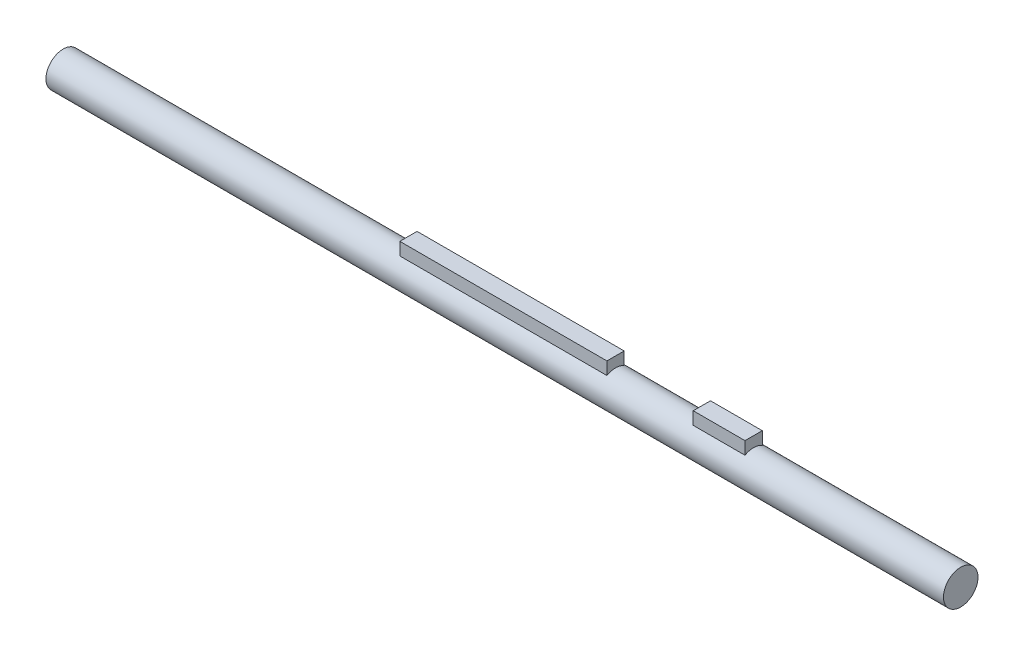
from build123d import *
from build123d.topology import SkipClean

# Parameters (mm, degrees)
SHAFT_DEPTH                     = 130
SHAFT_DEPTH_BACK                = 130
SKETCH2_R                       = 5
SHAFT_KEY_FOR_BICEPS_DEPTH      = 130
SHAFT_KEY_FOR_BICEPS_DEPTH_BACK = 30
SKETCH3_W                       = 5
SKETCH3_H                       = 8
CUT_EXTRUDE1_START              = -75
CUT_EXTRUDE1_DEPTH              = 75
CUT_EXTRUDE2_START              = -25
CUT_EXTRUDE2_DEPTH              = 25
BOSS_EXTRUDE1_DEPTH             = 15


with BuildPart() as part:
    # Sketch2 → Shaft (new, two sides: drawn at the far end of the back side and taken through both)
    with BuildSketch(Plane(origin=(0, 0, 0), x_dir=(0, 0, -1), z_dir=(1, 0, 0)).offset(-SHAFT_DEPTH_BACK)):
        Circle(SKETCH2_R)
    extrude(amount=SHAFT_DEPTH + SHAFT_DEPTH_BACK)

    # Sketch3 → Shaft Key for Biceps (add, two sides: drawn at the far end of the back side and taken through both)
    with BuildSketch(Plane(origin=(0, 0, 0), x_dir=(0, 0, -1), z_dir=(1, 0, 0)).offset(-SHAFT_KEY_FOR_BICEPS_DEPTH_BACK)):
        with Locations((0, 4)):
            Rectangle(SKETCH3_W, SKETCH3_H)
    extrude(amount=SHAFT_KEY_FOR_BICEPS_DEPTH + SHAFT_KEY_FOR_BICEPS_DEPTH_BACK)

    # Sketch5 → Cut-Extrude1 (cut)
    with BuildSketch(Plane(origin=(130, 0, 0), x_dir=(0, 0, -1), z_dir=(1, 0, 0)).offset(CUT_EXTRUDE1_START)):
        with BuildLine():
            Line((-2.5, 4.330127019), (-2.5, 8))
            Line((-2.5, 8), (2.5, 8))
            Line((2.5, 8), (2.5, 4.330127019))
            ThreePointArc((2.5, 4.330127019), (0, 5), (-2.5, 4.330127019))
        make_face()
    extrude(amount=CUT_EXTRUDE1_DEPTH, mode=Mode.SUBTRACT)

    # Sketch9 → Cut-Extrude2 (cut)
    with SkipClean():  # the faces are left unmerged after this step: merging them gives an invalid solid
        with BuildSketch(Plane(origin=(55, 0, 0), x_dir=(0, 0, -1), z_dir=(1, 0, 0)).offset(CUT_EXTRUDE2_START)):
            with BuildLine():
                Line((2.5, 4.330127019), (2.5, 8))
                Line((2.5, 8), (-2.5, 8))
                Line((-2.5, 8), (-2.5, 4.330127019))
                ThreePointArc((-2.5, 4.330127019), (0, 5), (2.5, 4.330127019))
            make_face()
        extrude(amount=CUT_EXTRUDE2_DEPTH, mode=Mode.SUBTRACT)

    # Sketch10 → Boss-Extrude1 (add)
    with SkipClean():  # the faces are left unmerged after this step: merging them gives an invalid solid
        with BuildSketch(Plane(origin=(55, 0, 0), x_dir=(0, 0, -1), z_dir=(1, 0, 0))):
            with BuildLine():
                Line((-2.5, 8), (-2.5, 4.330127019))
                ThreePointArc((-2.5, 4.330127019), (0, 5), (2.5, 4.330127019))
                Line((2.5, 4.330127019), (2.5, 8))
                Line((2.5, 8), (-2.5, 8))
            make_face()
        extrude(amount=BOSS_EXTRUDE1_DEPTH)


solid = part.part
